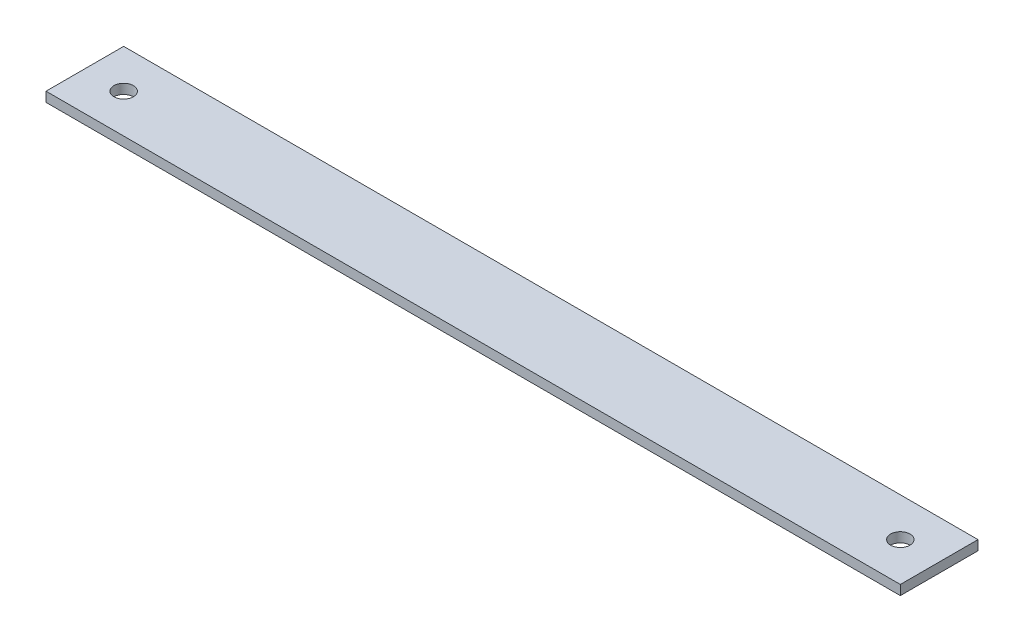
from build123d import *

# Parameters (mm, degrees)
SKETCH1_W           = 279.4
SKETCH1_H           = 25.4
BOSS_EXTRUDE1_DEPTH = 3.175
CUT_EXTRUDE1_REACH  = 142.312
SKETCH2_R           = 3.175


with BuildPart() as part:
    # Sketch1 → Boss-Extrude1 (new body)
    with BuildSketch(Plane(origin=(0, 0, 0), x_dir=(1, 0, 0), z_dir=(0, 1, 0))):
        Rectangle(SKETCH1_W, SKETCH1_H)
    extrude(amount=BOSS_EXTRUDE1_DEPTH)

    # Sketch2 → Cut-Extrude1 (cut, up to next)
    with BuildSketch(Plane(origin=(0, 3.175, 0), x_dir=(1, 0, 0), z_dir=(0, 1, 0)), mode=Mode.PRIVATE) as cut_extrude1_sk1:
        with Locations(Location((-127, 0, 0), (0, 0, 270))):
            Circle(SKETCH2_R)
    cut_extrude1_tool1 = extrude(cut_extrude1_sk1.sketch, amount=-CUT_EXTRUDE1_REACH, mode=Mode.PRIVATE) & part.part
    # Sketch2 → Cut-Extrude1 (cut, up to next)
    with BuildSketch(Plane(origin=(0, 3.175, 0), x_dir=(1, 0, 0), z_dir=(0, 1, 0)), mode=Mode.PRIVATE) as cut_extrude1_sk2:
        with Locations(Location((127, 0, 0), (0, 0, 270))):
            Circle(SKETCH2_R)
    cut_extrude1_tool2 = extrude(cut_extrude1_sk2.sketch, amount=-CUT_EXTRUDE1_REACH, mode=Mode.PRIVATE) & part.part
    add(cut_extrude1_tool1.solids().sort_by_distance((-127, 3.175, 0))[0], mode=Mode.SUBTRACT)
    add(cut_extrude1_tool2.solids().sort_by_distance((127, 3.175, 0))[0], mode=Mode.SUBTRACT)


solid = part.part
